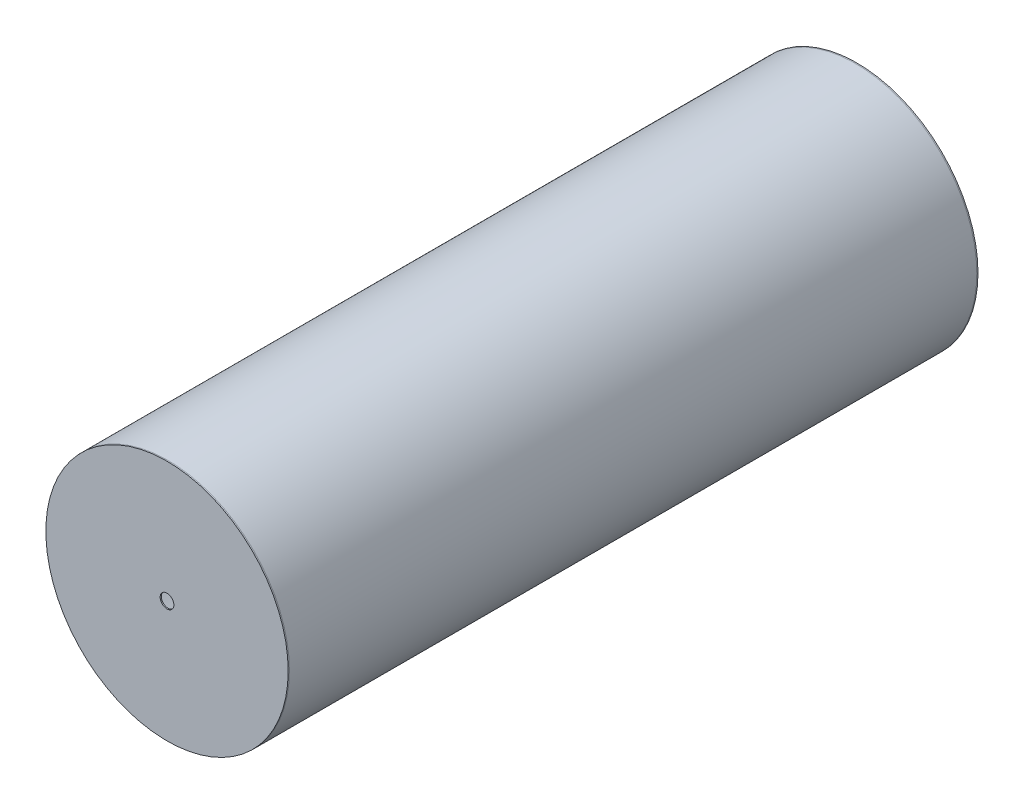
from build123d import *

# Parameters (mm, degrees)
SKETCH1_R           = 202
BOSS_EXTRUDE1_DEPTH = 2
SKETCH2_R           = 202
SKETCH2_R_2         = 200
BOSS_EXTRUDE2_DEPTH = 1145.92
SKETCH4_R           = 202
BOSS_EXTRUDE4_DEPTH = 2
SKETCH5_R           = 11.45
CUT_EXTRUDE1_DEPTH  = 1185.872991675


with BuildPart() as part:
    # Sketch1 → Boss-Extrude1 (new body)
    with BuildSketch(Plane.XY):
        Circle(SKETCH1_R)
    extrude(amount=BOSS_EXTRUDE1_DEPTH)


with BuildPart() as body_2:
    # Sketch2 → Boss-Extrude2 (new body)
    with BuildSketch(Plane.XY.offset(2)):
        Circle(SKETCH2_R)
        Circle(SKETCH2_R_2, mode=Mode.SUBTRACT)
    extrude(amount=BOSS_EXTRUDE2_DEPTH)


with BuildPart() as body_3:
    # Sketch4 → Boss-Extrude4 (new body)
    with BuildSketch(Plane.XY.offset(1147.92)):
        Circle(SKETCH4_R)
    extrude(amount=BOSS_EXTRUDE4_DEPTH)


with BuildPart() as cut_extrude1_tool:
    # Sketch5 → Cut-Extrude1 (new, through all)
    with BuildSketch(Plane.XY.offset(1149.92)):
        Circle(SKETCH5_R)
    extrude(amount=-CUT_EXTRUDE1_DEPTH)


with BuildPart() as part_1:
    add(part.part)

    # Cut-Extrude1: cut by cut_extrude1_tool
    add(cut_extrude1_tool.part, mode=Mode.SUBTRACT)


with BuildPart() as body_3_1:
    add(body_3.part)

    # Cut-Extrude1: cut by cut_extrude1_tool
    add(cut_extrude1_tool.part, mode=Mode.SUBTRACT)


solid = Compound([body_2.part, part_1.part, body_3_1.part])
